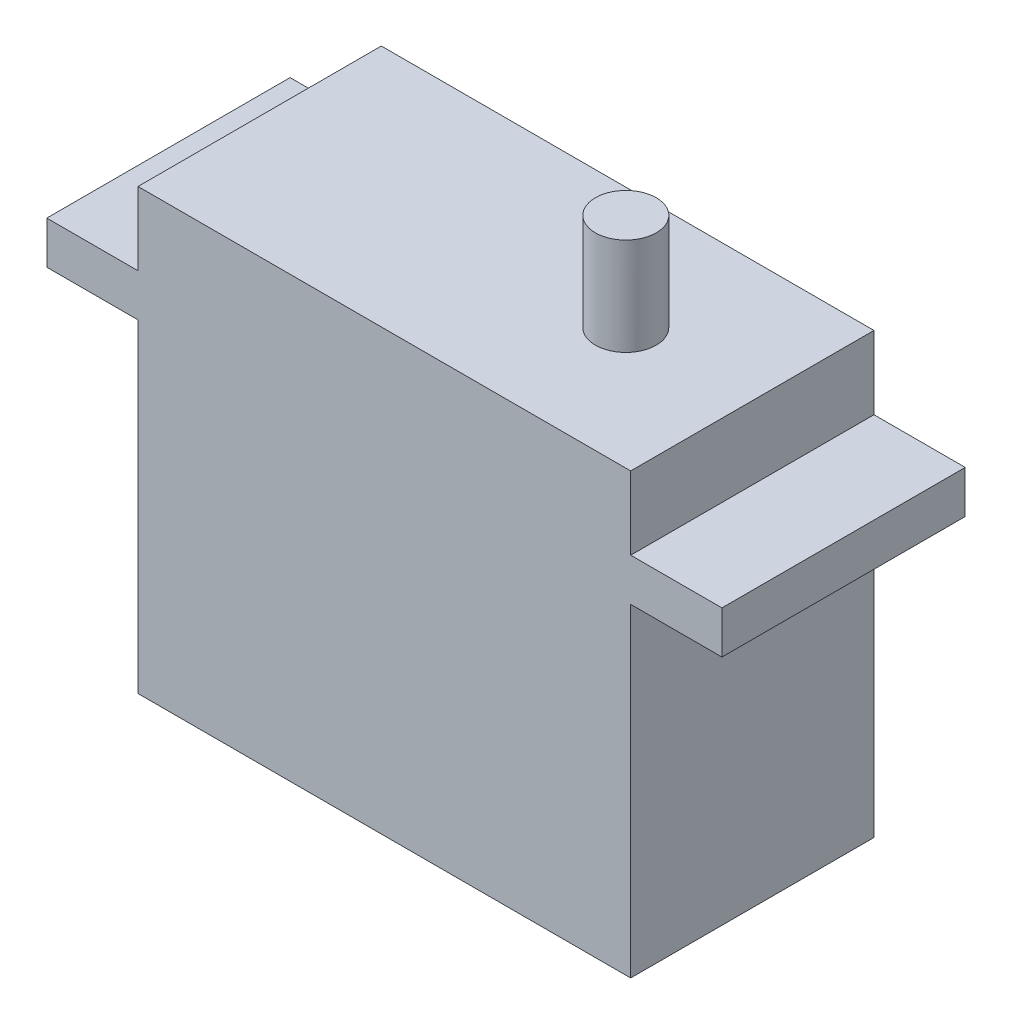
from build123d import *

# Parameters (mm, degrees)
SKETCH1_W           = 55.5
SKETCH1_H           = 20
BOSS_EXTRUDE1_DEPTH = 36.1
SKETCH2_W           = 7.5
SKETCH2_H           = 20
CUT_EXTRUDE1_DEPTH  = 26.6
SKETCH3_W           = 7.5
SKETCH3_H           = 20
CUT_EXTRUDE2_DEPTH  = 6
SKETCH4_R           = 2.5
BOSS_EXTRUDE2_DEPTH = 8


with BuildPart() as part:
    # Sketch1 → Boss-Extrude1 (new body)
    with BuildSketch(Plane(origin=(0, 0, 0), x_dir=(1, 0, 0), z_dir=(0, 1, 0))):
        Rectangle(SKETCH1_W, SKETCH1_H)
    extrude(amount=BOSS_EXTRUDE1_DEPTH)

    # Sketch2 → Cut-Extrude1 (cut)
    with BuildSketch(Plane.XZ):
        with Locations((24, 0)):
            Rectangle(SKETCH2_W, SKETCH2_H)
        with Locations((-24, 0)):
            Rectangle(SKETCH2_W, SKETCH2_H)
    extrude(amount=-CUT_EXTRUDE1_DEPTH, mode=Mode.SUBTRACT)

    # Sketch3 → Cut-Extrude2 (cut)
    with BuildSketch(Plane(origin=(0, 36.1, 0), x_dir=(1, 0, 0), z_dir=(0, 1, 0))):
        with Locations((24, 0)):
            Rectangle(SKETCH3_W, SKETCH3_H)
        with Locations((-24, 0)):
            Rectangle(SKETCH3_W, SKETCH3_H)
    extrude(amount=-CUT_EXTRUDE2_DEPTH, mode=Mode.SUBTRACT)

    # Sketch4 → Boss-Extrude2 (add)
    with BuildSketch(Plane(origin=(0, 36.1, 0), x_dir=(1, 0, 0), z_dir=(0, 1, 0))):
        with Locations(Location((9.85, 0, 0), (0, 0, 90))):
            Circle(SKETCH4_R)
    extrude(amount=BOSS_EXTRUDE2_DEPTH)


solid = part.part
